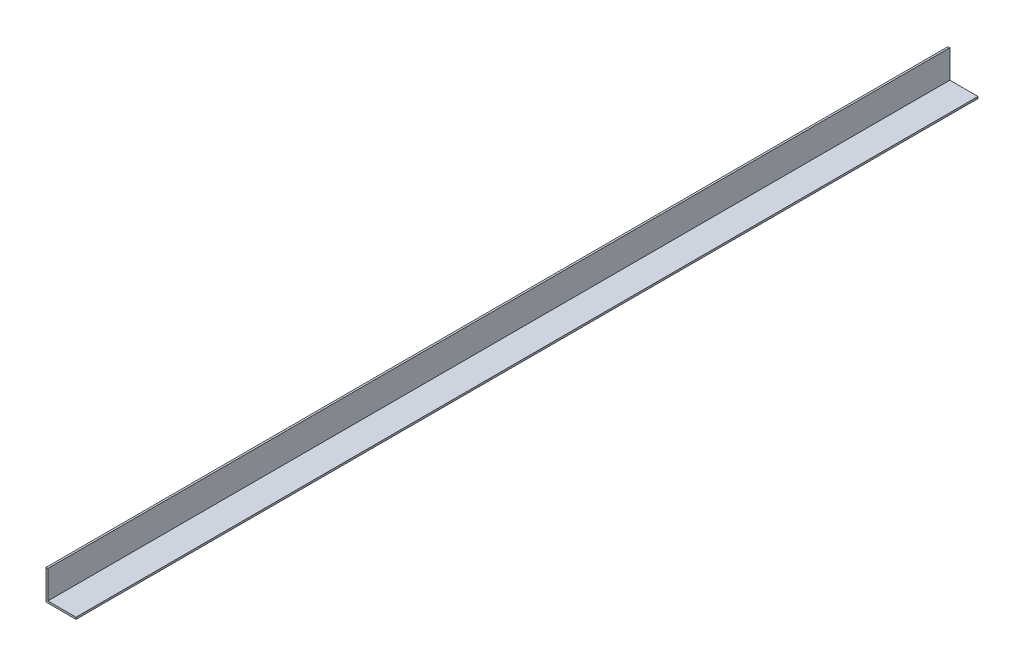
from build123d import *

# Parameters (mm, degrees)
SALIENTE_EXTRUIR1_DEPTH = 6100


with BuildPart() as part:
    # Croquis1 → Saliente-Extruir1 (new body)
    with BuildSketch(Plane.XY):
        Polygon((0, 203), (0, 0), (203, 0), (203, 12.7), (12.7, 12.7), (12.7, 203), align=None)
    extrude(amount=-SALIENTE_EXTRUIR1_DEPTH)


solid = part.part
